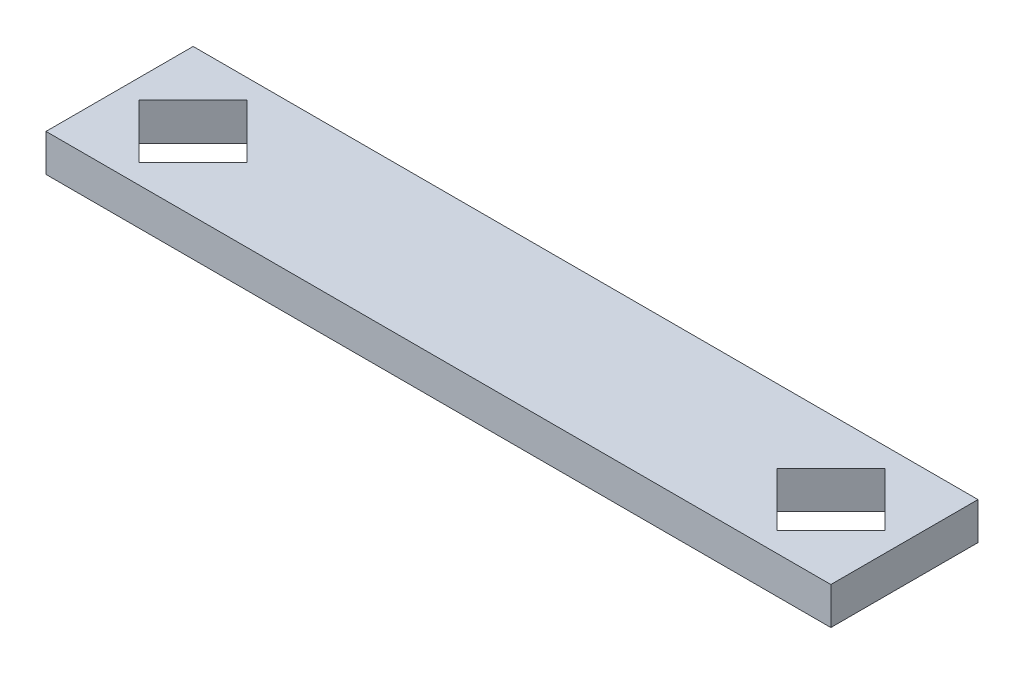
from build123d import *

# Parameters (mm, degrees)
SKETCH1_W           = 80
SKETCH1_H           = 15
BOSS_EXTRUDE1_DEPTH = 3.8


with BuildPart() as part:
    # Sketch1 → Boss-Extrude1 (new body)
    with BuildSketch(Plane(origin=(0, 0, 0), x_dir=(1, 0, 0), z_dir=(0, 1, 0))):
        Rectangle(SKETCH1_W, SKETCH1_H)
        Polygon((-38, 0), (-32.5, -5.5), (-27, 0), (-32.5, 5.5), align=None, mode=Mode.SUBTRACT)
        Polygon((32.5, 5.5), (27, 0), (32.5, -5.5), (38, 0), align=None, mode=Mode.SUBTRACT)
    extrude(amount=BOSS_EXTRUDE1_DEPTH)


solid = part.part
